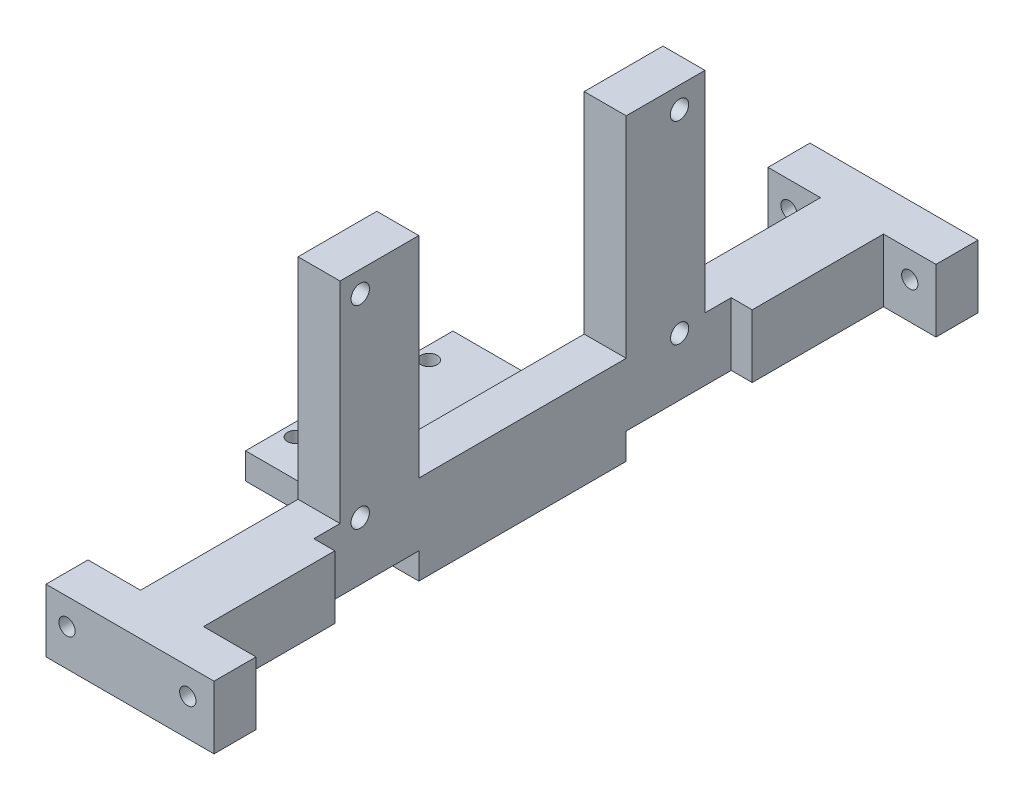
from build123d import *

# Parameters (mm, degrees)
SKETCH_1_W          = 12
SKETCH_1_H          = 12
EXTRUDE_1_DEPTH     = 129.5
SKETCH_3_W          = 32
SKETCH_3_H          = 12
EXTRUDE_2_DEPTH     = 8
SKETCH_4_W          = 32
SKETCH_4_H          = 12
EXTRUDE_3_DEPTH     = 8
SKETCH_5_W          = 79.5
SKETCH_5_H          = 52
EXTRUDE_4_DEPTH     = 8
SKETCH_6_W          = 59.5
SKETCH_6_H          = 40
CUT_EXTRUDE_1_DEPTH = 10
SKETCH_10_W         = 8
SKETCH_10_H         = 40
EXTRUDE_7_DEPTH     = 10
SKETCH_11_W         = 8
SKETCH_11_H         = 40
EXTRUDE_8_DEPTH     = 10
SKETCH_13_W         = 8
SKETCH_13_H         = 40
CUT_EXTRUDE_3_DEPTH = 5
SKETCH_14_W         = 8
SKETCH_14_H         = 40
CUT_EXTRUDE_4_DEPTH = 5
SKETCH_17_R         = 1.55
CUT_EXTRUDE_5_DEPTH = 146.870661889
SKETCH_17_2_R       = 1.55
CUT_EXTRUDE_6_DEPTH = 146.870661889
SKETCH_19_W         = 4
SKETCH_19_H         = 79.5
CUT_EXTRUDE_7_DEPTH = 145.091117006
SKETCH_20_W         = 8
SKETCH_20_H         = 39.5
EXTRUDE_9_DEPTH     = 5
SKETCH_21_W         = 39.5
SKETCH_21_H         = 5
EXTRUDE_10_DEPTH    = 25
SKETCH_23_R         = 1.55
CUT_EXTRUDE_8_DEPTH = 153.040290713
CUT_EXTRUDE_9_REACH = 150.699
SKETCH_25_R         = 1.75
SKETCH_25_R_2       = 1.726022487
EXTRUDE_11_DEPTH    = 39.5


with BuildPart() as part:
    # 草图1 → 凸台-拉伸1 (new body)
    with BuildSketch(Plane.XY):
        Rectangle(SKETCH_1_W, SKETCH_1_H)
    extrude(amount=EXTRUDE_1_DEPTH)

    # 草图3 → 凸台-拉伸2 (add)
    with BuildSketch(Plane.XY.offset(129.5)):
        Rectangle(SKETCH_3_W, SKETCH_3_H)
    extrude(amount=EXTRUDE_2_DEPTH)

    # 草图4 → 凸台-拉伸3 (add)
    with BuildSketch(Plane(origin=(0, 0, 0), x_dir=(-1, 0, 0), z_dir=(0, 0, -1))):
        Rectangle(SKETCH_4_W, SKETCH_4_H)
    extrude(amount=EXTRUDE_3_DEPTH)

    # 草图5 → 凸台-拉伸4 (add)
    with BuildSketch(Plane.ZY.offset(6)):
        with Locations((64.75, 20)):
            Rectangle(SKETCH_5_W, SKETCH_5_H)
    extrude(amount=-EXTRUDE_4_DEPTH)

    # 草图6 → 切除-拉伸1 (cut)
    with BuildSketch(Plane(origin=(2, 0, 0), x_dir=(0, 0, -1), z_dir=(1, 0, 0))):
        with Locations((-64.75, 26)):
            Rectangle(SKETCH_6_W, SKETCH_6_H)
    extrude(amount=-CUT_EXTRUDE_1_DEPTH, mode=Mode.SUBTRACT)

    # 草图10 → 凸台-拉伸7 (add)
    with BuildSketch(Plane.XY.offset(35)):
        with Locations((-2, 26)):
            Rectangle(SKETCH_10_W, SKETCH_10_H)
    extrude(amount=EXTRUDE_7_DEPTH)

    # 草图11 → 凸台-拉伸8 (add)
    with BuildSketch(Plane(origin=(0, 0, 94.5), x_dir=(-1, 0, 0), z_dir=(0, 0, -1))):
        with Locations((2, 26)):
            Rectangle(SKETCH_11_W, SKETCH_11_H)
    extrude(amount=EXTRUDE_8_DEPTH)

    # 草图13 → 切除-拉伸3 (cut)
    with BuildSketch(Plane(origin=(0, 0, 25), x_dir=(-1, 0, 0), z_dir=(0, 0, -1))):
        with Locations((2, 26)):
            Rectangle(SKETCH_13_W, SKETCH_13_H)
    extrude(amount=-CUT_EXTRUDE_3_DEPTH, mode=Mode.SUBTRACT)

    # 草图14 → 切除-拉伸4 (cut)
    with BuildSketch(Plane.XY.offset(104.5)):
        with Locations((-2, 26)):
            Rectangle(SKETCH_14_W, SKETCH_14_H)
    extrude(amount=-CUT_EXTRUDE_4_DEPTH, mode=Mode.SUBTRACT)

    # 草图17 → 切除-拉伸5 (cut, through all)
    with BuildSketch(Plane(origin=(0, 0, 129.5), x_dir=(-1, 0, 0), z_dir=(0, 0, -1))):
        with Locations((12, 1)):
            Circle(SKETCH_17_R)
        with Locations((-11, 1)):
            Circle(SKETCH_17_R)
    extrude(amount=-CUT_EXTRUDE_5_DEPTH, mode=Mode.SUBTRACT)

    # 草图17<2> → 切除-拉伸6 (cut, through all)
    with BuildSketch(Plane(origin=(0, 0, 129.5), x_dir=(-1, 0, 0), z_dir=(0, 0, -1))):
        with Locations((12, 1)):
            Circle(SKETCH_17_2_R)
        with Locations((-11, 1)):
            Circle(SKETCH_17_2_R)
    extrude(amount=CUT_EXTRUDE_6_DEPTH, mode=Mode.SUBTRACT)

    # 草图19 → 切除-拉伸7 (cut, through all)
    with BuildSketch(Plane(origin=(0, 6, 0), x_dir=(1, 0, 0), z_dir=(0, 1, 0))):
        with Locations((4, -64.75)):
            Rectangle(SKETCH_19_W, SKETCH_19_H)
    extrude(amount=-CUT_EXTRUDE_7_DEPTH, mode=Mode.SUBTRACT)

    # 草图20 → 凸台-拉伸9 (add)
    with BuildSketch(Plane.XZ.offset(6)):
        with Locations((-2, 64.75)):
            Rectangle(SKETCH_20_W, SKETCH_20_H)
    extrude(amount=EXTRUDE_9_DEPTH)

    # 草图21 → 凸台-拉伸10 (add)
    with BuildSketch(Plane.ZY.offset(6)):
        with Locations((64.75, -8.5)):
            Rectangle(SKETCH_21_W, SKETCH_21_H)
    extrude(amount=EXTRUDE_10_DEPTH)

    # 草图23 → 切除-拉伸8 (cut, through all)
    with BuildSketch(Plane.XZ.offset(11)):
        with Locations(Location((-28.5, 77.45, 0), (0, 0, 270))):
            Circle(SKETCH_23_R)
        with Locations(Location((-28.5, 52.05, 0), (0, 0, 270))):
            Circle(SKETCH_23_R)
    extrude(amount=-CUT_EXTRUDE_8_DEPTH, mode=Mode.SUBTRACT)

    # 草图25 → 切除-拉伸9 (cut, up to next)
    with BuildSketch(Plane(origin=(2, 0, 0), x_dir=(0, 0, -1), z_dir=(1, 0, 0)), mode=Mode.PRIVATE) as cut_extrude_9_sk1:
        with Locations((-95.65, 41.95)):
            Circle(SKETCH_25_R)
    cut_extrude_9_tool1 = extrude(cut_extrude_9_sk1.sketch, amount=-CUT_EXTRUDE_9_REACH, mode=Mode.PRIVATE) & part.part
    # 草图25 → 切除-拉伸9 (cut, up to next)
    with BuildSketch(Plane(origin=(2, 0, 0), x_dir=(0, 0, -1), z_dir=(1, 0, 0)), mode=Mode.PRIVATE) as cut_extrude_9_sk2:
        with Locations((-95.65, 5.05)):
            Circle(SKETCH_25_R)
    cut_extrude_9_tool2 = extrude(cut_extrude_9_sk2.sketch, amount=-CUT_EXTRUDE_9_REACH, mode=Mode.PRIVATE) & part.part
    # 草图25 → 切除-拉伸9 (cut, up to next)
    with BuildSketch(Plane(origin=(2, 0, 0), x_dir=(0, 0, -1), z_dir=(1, 0, 0)), mode=Mode.PRIVATE) as cut_extrude_9_sk3:
        with Locations((-34.826022487, 5.05)):
            Circle(SKETCH_25_R_2)
    cut_extrude_9_tool3 = extrude(cut_extrude_9_sk3.sketch, amount=-CUT_EXTRUDE_9_REACH, mode=Mode.PRIVATE) & part.part
    # 草图25 → 切除-拉伸9 (cut, up to next)
    with BuildSketch(Plane(origin=(2, 0, 0), x_dir=(0, 0, -1), z_dir=(1, 0, 0)), mode=Mode.PRIVATE) as cut_extrude_9_sk4:
        with Locations((-34.85, 41.95)):
            Circle(SKETCH_25_R)
    cut_extrude_9_tool4 = extrude(cut_extrude_9_sk4.sketch, amount=-CUT_EXTRUDE_9_REACH, mode=Mode.PRIVATE) & part.part
    add(cut_extrude_9_tool1.solids().sort_by_distance((2, 41.95, 95.65))[0], mode=Mode.SUBTRACT)
    add(cut_extrude_9_tool2.solids().sort_by_distance((2, 5.05, 95.65))[0], mode=Mode.SUBTRACT)
    add(cut_extrude_9_tool3.solids().sort_by_distance((2, 5.05, 34.826022))[0], mode=Mode.SUBTRACT)
    add(cut_extrude_9_tool4.solids().sort_by_distance((2, 41.95, 34.85))[0], mode=Mode.SUBTRACT)

    # 草图26 → 凸台-拉伸11 (add)
    with BuildSketch(Plane(origin=(0, 0, 45), x_dir=(-1, 0, 0), z_dir=(0, 0, -1))):
        Polygon((6, -6), (6, -1), (11, -6), align=None)
    extrude(amount=-EXTRUDE_11_DEPTH)


solid = part.part
